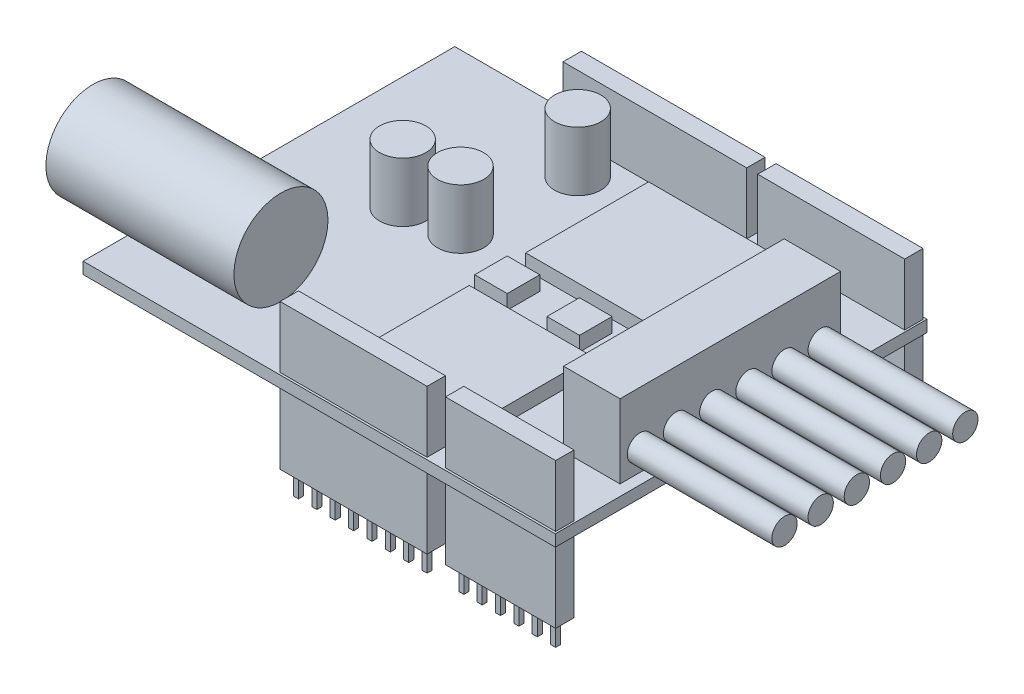
from build123d import *

# Parameters (mm, degrees)
ESQUISSE1_W               = 65.3
ESQUISSE1_H               = 51.4
BOSS_EXTRU_1_DEPTH        = 1.6
ESQUISSE2_W               = 17
ESQUISSE2_H               = 17
BOSS_EXTRU_2_DEPTH        = 2
BOSS_EXTRU_2_2_DEPTH      = 2
ESQUISSE2_W_2             = 4.5
ESQUISSE2_H_2             = 4.5
BOSS_EXTRU_2_3_DEPTH      = 2
BOSS_EXTRU_2_4_DEPTH      = 2
ESQUISSE3_R               = 3.2
BOSS_EXTRU_3_DEPTH        = 8.2
BOSS_EXTRU_3_2_DEPTH      = 8.2
BOSS_EXTRU_3_3_DEPTH      = 8.2
ESQUISSE4_W               = 7.8
ESQUISSE4_H               = 30.5
BOSS_EXTRU_4_DEPTH        = 10.2
ESQUISSE5_R               = 1.75
BOSS_EXTRU_5_DEPTH        = 20
BOSS_EXTRU_5_2_DEPTH      = 20
BOSS_EXTRU_5_3_DEPTH      = 20
BOSS_EXTRU_5_4_DEPTH      = 20
BOSS_EXTRU_5_5_DEPTH      = 20
BOSS_EXTRU_5_6_DEPTH      = 20
BOSS_EXTRU_6_DEPTH        = 6.5
BOSS_EXTRU_6_DEPTH_BACK   = 19.5
ESQUISSE6_R               = 6.5
BOSS_EXTRU_7_DEPTH        = 8.5
BOSS_EXTRU_7_DEPTH_BACK   = 11.6
ESQUISSE7_W               = 20.32
ESQUISSE7_H               = 2.54
BOSS_EXTRU_7_2_DEPTH      = 8.5
BOSS_EXTRU_7_2_DEPTH_BACK = 11.6
ESQUISSE7_W_2             = 25.4
BOSS_EXTRU_7_3_DEPTH      = 8.5
BOSS_EXTRU_7_3_DEPTH_BACK = 11.6
ESQUISSE7_W_3             = 15.24
BOSS_EXTRU_7_4_DEPTH      = 8.5
BOSS_EXTRU_7_4_DEPTH_BACK = 11.6
ESQUISSE8_W               = 0.7
ESQUISSE8_H               = 0.7
BOSS_EXTRU_8_DEPTH        = 13.2


with BuildPart() as part:
    # Esquisse1 → Boss.-Extru.1 (new body)
    with BuildSketch(Plane(origin=(0, 0, 0), x_dir=(1, 0, 0), z_dir=(0, 1, 0))):
        Rectangle(ESQUISSE1_W, ESQUISSE1_H)
    extrude(amount=BOSS_EXTRU_1_DEPTH)



with BuildPart() as body_2:
    # Esquisse2 → Boss.-Extru.2 (new body)
    with BuildSketch(Plane(origin=(0, 1.6, 0), x_dir=(1, 0, 0), z_dir=(0, 1, 0))):
        with Locations((7.45, 12.4)):
            Rectangle(ESQUISSE2_W, ESQUISSE2_H)
    extrude(amount=BOSS_EXTRU_2_DEPTH)


with BuildPart() as body_3:
    # Esquisse2 → Boss.-Extru.2 2 (new body)
    with BuildSketch(Plane(origin=(0, 1.6, 0), x_dir=(1, 0, 0), z_dir=(0, 1, 0))):
        with Locations((7.45, -12.4)):
            Rectangle(ESQUISSE2_W, ESQUISSE2_H)
    extrude(amount=BOSS_EXTRU_2_2_DEPTH)


with BuildPart() as body_4:
    # Esquisse2 → Boss.-Extru.2 3 (new body)
    with BuildSketch(Plane(origin=(0, 1.6, 0), x_dir=(1, 0, 0), z_dir=(0, 1, 0))):
        with Locations((0.3, 0)):
            Rectangle(ESQUISSE2_W_2, ESQUISSE2_H_2)
    extrude(amount=BOSS_EXTRU_2_3_DEPTH)


with BuildPart() as body_5:
    # Esquisse2 → Boss.-Extru.2 4 (new body)
    with BuildSketch(Plane(origin=(0, 1.6, 0), x_dir=(1, 0, 0), z_dir=(0, 1, 0))):
        with Locations((10.3, 0)):
            Rectangle(ESQUISSE2_W_2, ESQUISSE2_H_2)
    extrude(amount=BOSS_EXTRU_2_4_DEPTH)


with BuildPart() as body_6:
    # Esquisse3 → Boss.-Extru.3 (new body)
    with BuildSketch(Plane(origin=(0, 1.6, 0), x_dir=(1, 0, 0), z_dir=(0, 1, 0))):
        with Locations(Location((-8.55, 18.6, 0), (0, 0, 270))):
            Circle(ESQUISSE3_R)
    extrude(amount=BOSS_EXTRU_3_DEPTH)


with BuildPart() as body_7:
    # Esquisse3 → Boss.-Extru.3 2 (new body)
    with BuildSketch(Plane(origin=(0, 1.6, 0), x_dir=(1, 0, 0), z_dir=(0, 1, 0))):
        with Locations(Location((-9.75, 3.6, 0), (0, 0, 270))):
            Circle(ESQUISSE3_R)
    extrude(amount=BOSS_EXTRU_3_2_DEPTH)


with BuildPart() as body_8:
    # Esquisse3 → Boss.-Extru.3 3 (new body)
    with BuildSketch(Plane(origin=(0, 1.6, 0), x_dir=(1, 0, 0), z_dir=(0, 1, 0))):
        with Locations(Location((-16.95, 2.8, 0), (0, 0, 270))):
            Circle(ESQUISSE3_R)
    extrude(amount=BOSS_EXTRU_3_3_DEPTH)


with BuildPart() as body_9:
    # Esquisse4 → Boss.-Extru.4 (new body)
    with BuildSketch(Plane(origin=(0, 1.6, 0), x_dir=(1, 0, 0), z_dir=(0, 1, 0))):
        with Locations((27.25, 0)):
            Rectangle(ESQUISSE4_W, ESQUISSE4_H)
    extrude(amount=BOSS_EXTRU_4_DEPTH)


with BuildPart() as body_10:
    # Esquisse5 → Boss.-Extru.5 (new body)
    with BuildSketch(Plane(origin=(31.15, 0, 0), x_dir=(0, 0, -1), z_dir=(1, 0, 0))):
        with Locations((12.5, 4.6)):
            Circle(ESQUISSE5_R)
    extrude(amount=BOSS_EXTRU_5_DEPTH)


with BuildPart() as body_11:
    # Esquisse5 → Boss.-Extru.5 2 (new body)
    with BuildSketch(Plane(origin=(31.15, 0, 0), x_dir=(0, 0, -1), z_dir=(1, 0, 0))):
        with Locations((7.5, 4.6)):
            Circle(ESQUISSE5_R)
    extrude(amount=BOSS_EXTRU_5_2_DEPTH)


with BuildPart() as body_12:
    # Esquisse5 → Boss.-Extru.5 3 (new body)
    with BuildSketch(Plane(origin=(31.15, 0, 0), x_dir=(0, 0, -1), z_dir=(1, 0, 0))):
        with Locations((2.5, 4.6)):
            Circle(ESQUISSE5_R)
    extrude(amount=BOSS_EXTRU_5_3_DEPTH)


with BuildPart() as body_13:
    # Esquisse5 → Boss.-Extru.5 4 (new body)
    with BuildSketch(Plane(origin=(31.15, 0, 0), x_dir=(0, 0, -1), z_dir=(1, 0, 0))):
        with Locations((-2.5, 4.6)):
            Circle(ESQUISSE5_R)
    extrude(amount=BOSS_EXTRU_5_4_DEPTH)


with BuildPart() as body_14:
    # Esquisse5 → Boss.-Extru.5 5 (new body)
    with BuildSketch(Plane(origin=(31.15, 0, 0), x_dir=(0, 0, -1), z_dir=(1, 0, 0))):
        with Locations((-7.5, 4.6)):
            Circle(ESQUISSE5_R)
    extrude(amount=BOSS_EXTRU_5_5_DEPTH)


with BuildPart() as body_15:
    # Esquisse5 → Boss.-Extru.5 6 (new body)
    with BuildSketch(Plane(origin=(31.15, 0, 0), x_dir=(0, 0, -1), z_dir=(1, 0, 0))):
        with Locations((-12.5, 4.6)):
            Circle(ESQUISSE5_R)
    extrude(amount=BOSS_EXTRU_5_6_DEPTH)


with BuildPart() as body_16:
    # Esquisse6 → Boss.-Extru.6 (new, two sides: drawn at the far end of the back side and taken through both)
    with BuildSketch(Plane.ZY.offset(32.65).offset(-BOSS_EXTRU_6_DEPTH_BACK)):
        with Locations(Location((17.837314043, 9.090114105, 0), (0, 0, 180))):
            Circle(ESQUISSE6_R)
    extrude(amount=BOSS_EXTRU_6_DEPTH + BOSS_EXTRU_6_DEPTH_BACK)


with BuildPart() as body_17:
    # Esquisse7 → Boss.-Extru.7 (new, two sides: drawn at the far end of the back side and taken through both)
    with BuildSketch(Plane(origin=(0, 1.6, 0), x_dir=(1, 0, 0), z_dir=(0, 1, 0)).offset(-BOSS_EXTRU_7_DEPTH_BACK)):
        with Locations((22.24, 24.13)):
            Rectangle(ESQUISSE7_W, ESQUISSE7_H)
    extrude(amount=BOSS_EXTRU_7_DEPTH + BOSS_EXTRU_7_DEPTH_BACK)


with BuildPart() as body_18:
    # Esquisse7 → Boss.-Extru.7 2 (new, two sides: drawn at the far end of the back side and taken through both)
    with BuildSketch(Plane(origin=(0, 1.6, 0), x_dir=(1, 0, 0), z_dir=(0, 1, 0)).offset(-BOSS_EXTRU_7_2_DEPTH_BACK)):
        with Locations((-2.14, 24.13)):
            Rectangle(ESQUISSE7_W_2, ESQUISSE7_H)
    extrude(amount=BOSS_EXTRU_7_2_DEPTH + BOSS_EXTRU_7_2_DEPTH_BACK)


with BuildPart() as body_19:
    # Esquisse7 → Boss.-Extru.7 3 (new, two sides: drawn at the far end of the back side and taken through both)
    with BuildSketch(Plane(origin=(0, 1.6, 0), x_dir=(1, 0, 0), z_dir=(0, 1, 0)).offset(-BOSS_EXTRU_7_3_DEPTH_BACK)):
        with Locations((24.78, -24.13)):
            Rectangle(ESQUISSE7_W_3, ESQUISSE7_H)
    extrude(amount=BOSS_EXTRU_7_3_DEPTH + BOSS_EXTRU_7_3_DEPTH_BACK)


with BuildPart() as body_20:
    # Esquisse7 → Boss.-Extru.7 4 (new, two sides: drawn at the far end of the back side and taken through both)
    with BuildSketch(Plane(origin=(0, 1.6, 0), x_dir=(1, 0, 0), z_dir=(0, 1, 0)).offset(-BOSS_EXTRU_7_4_DEPTH_BACK)):
        with Locations((4.46, -24.13)):
            Rectangle(ESQUISSE7_W, ESQUISSE7_H)
    extrude(amount=BOSS_EXTRU_7_4_DEPTH + BOSS_EXTRU_7_4_DEPTH_BACK)


with BuildPart() as part_1:
    add(part.part)

    add(body_17.part)  # Boss.-Extru.8 merges body 17

    add(body_18.part)  # Boss.-Extru.8 merges body 18

    add(body_19.part)  # Boss.-Extru.8 merges body 19

    add(body_20.part)  # Boss.-Extru.8 merges body 20
    # Esquisse8 → Boss.-Extru.8 (add)
    with BuildSketch(Plane.XZ):
        with Locations((13.35, -24.13)):
            Rectangle(ESQUISSE8_W, ESQUISSE8_H)
        with Locations((15.89, -24.13)):
            Rectangle(ESQUISSE8_W, ESQUISSE8_H)
        with Locations((18.43, -24.13)):
            Rectangle(ESQUISSE8_W, ESQUISSE8_H)
        with Locations((20.97, -24.13)):
            Rectangle(ESQUISSE8_W, ESQUISSE8_H)
        with Locations((23.51, -24.13)):
            Rectangle(ESQUISSE8_W, ESQUISSE8_H)
        with Locations((26.05, -24.13)):
            Rectangle(ESQUISSE8_W, ESQUISSE8_H)
        with Locations((28.59, -24.13)):
            Rectangle(ESQUISSE8_W, ESQUISSE8_H)
        with Locations((31.13, -24.13)):
            Rectangle(ESQUISSE8_W, ESQUISSE8_H)
        with Locations((9.29, -24.13)):
            Rectangle(ESQUISSE8_W, ESQUISSE8_H)
        with Locations((6.75, -24.13)):
            Rectangle(ESQUISSE8_W, ESQUISSE8_H)
        with Locations((4.21, -24.13)):
            Rectangle(ESQUISSE8_W, ESQUISSE8_H)
        with Locations((1.67, -24.13)):
            Rectangle(ESQUISSE8_W, ESQUISSE8_H)
        with Locations((-0.87, -24.13)):
            Rectangle(ESQUISSE8_W, ESQUISSE8_H)
        with Locations((-3.41, -24.13)):
            Rectangle(ESQUISSE8_W, ESQUISSE8_H)
        with Locations((-5.95, -24.13)):
            Rectangle(ESQUISSE8_W, ESQUISSE8_H)
        with Locations((-8.49, -24.13)):
            Rectangle(ESQUISSE8_W, ESQUISSE8_H)
        with Locations((-11.03, -24.13)):
            Rectangle(ESQUISSE8_W, ESQUISSE8_H)
        with Locations((-13.57, -24.13)):
            Rectangle(ESQUISSE8_W, ESQUISSE8_H)
        with Locations((18.43, 24.13)):
            Rectangle(ESQUISSE8_W, ESQUISSE8_H)
        with Locations((13.35, 24.13)):
            Rectangle(ESQUISSE8_W, ESQUISSE8_H)
        with Locations((20.97, 24.13)):
            Rectangle(ESQUISSE8_W, ESQUISSE8_H)
        with Locations((23.51, 24.13)):
            Rectangle(ESQUISSE8_W, ESQUISSE8_H)
        with Locations((26.05, 24.13)):
            Rectangle(ESQUISSE8_W, ESQUISSE8_H)
        with Locations((28.59, 24.13)):
            Rectangle(ESQUISSE8_W, ESQUISSE8_H)
        with Locations((31.13, 24.13)):
            Rectangle(ESQUISSE8_W, ESQUISSE8_H)
        with Locations((10.81, 24.13)):
            Rectangle(ESQUISSE8_W, ESQUISSE8_H)
        with Locations((8.27, 24.13)):
            Rectangle(ESQUISSE8_W, ESQUISSE8_H)
        with Locations((5.73, 24.13)):
            Rectangle(ESQUISSE8_W, ESQUISSE8_H)
        with Locations((3.19, 24.13)):
            Rectangle(ESQUISSE8_W, ESQUISSE8_H)
        with Locations((0.65, 24.13)):
            Rectangle(ESQUISSE8_W, ESQUISSE8_H)
        with Locations((-1.89, 24.13)):
            Rectangle(ESQUISSE8_W, ESQUISSE8_H)
        with Locations((-4.43, 24.13)):
            Rectangle(ESQUISSE8_W, ESQUISSE8_H)
    extrude(amount=BOSS_EXTRU_8_DEPTH)


solid = Compound([body_2.part, body_3.part, body_4.part, body_5.part, body_6.part, body_7.part, body_8.part, body_9.part, body_10.part, body_11.part, body_12.part, body_13.part, body_14.part, body_15.part, body_16.part, part_1.part])
